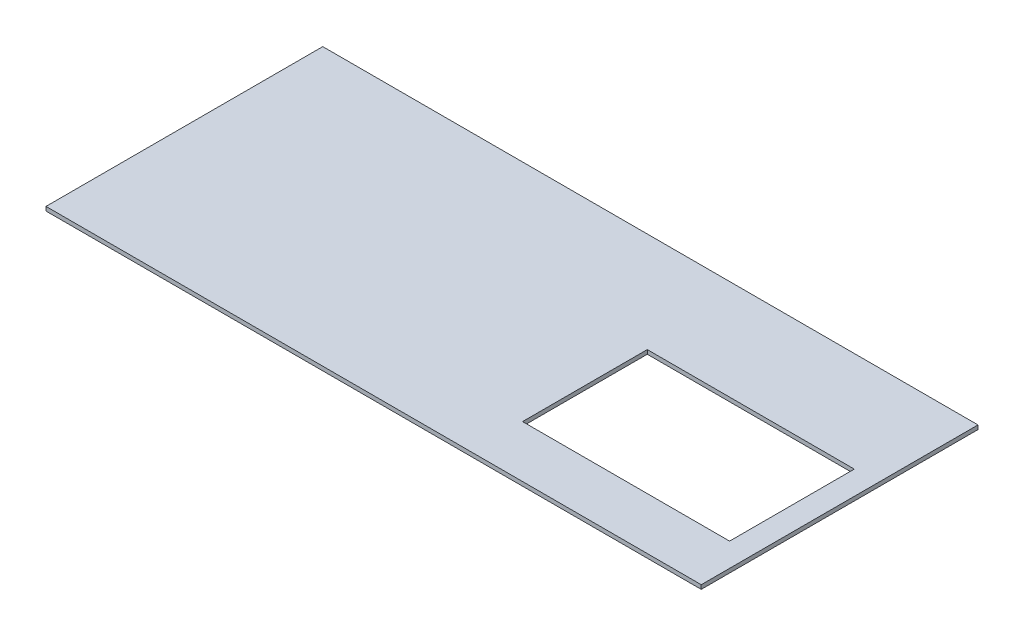
from build123d import *

# Parameters (mm, degrees)
SKETCH1_W           = 511.175
SKETCH1_H           = 215.9
BOSS_EXTRUDE1_DEPTH = 3.175
SKETCH3_W           = 161.5
SKETCH3_H           = 97.3
CUT_EXTRUDE1_DEPTH  = 278.467571585


with BuildPart() as part:
    # Sketch1 → Boss-Extrude1 (new body)
    with BuildSketch(Plane(origin=(0, 0, 0), x_dir=(1, 0, 0), z_dir=(0, 1, 0))):
        Rectangle(SKETCH1_W, SKETCH1_H)
    extrude(amount=BOSS_EXTRUDE1_DEPTH)

    # Sketch3 → Cut-Extrude1 (cut, through all)
    with BuildSketch(Plane(origin=(0, 3.175, 0), x_dir=(1, 0, 0), z_dir=(0, 1, 0))):
        with Locations((156.4375, -18.8)):
            Rectangle(SKETCH3_W, SKETCH3_H)
    extrude(amount=-CUT_EXTRUDE1_DEPTH, mode=Mode.SUBTRACT)


solid = part.part
